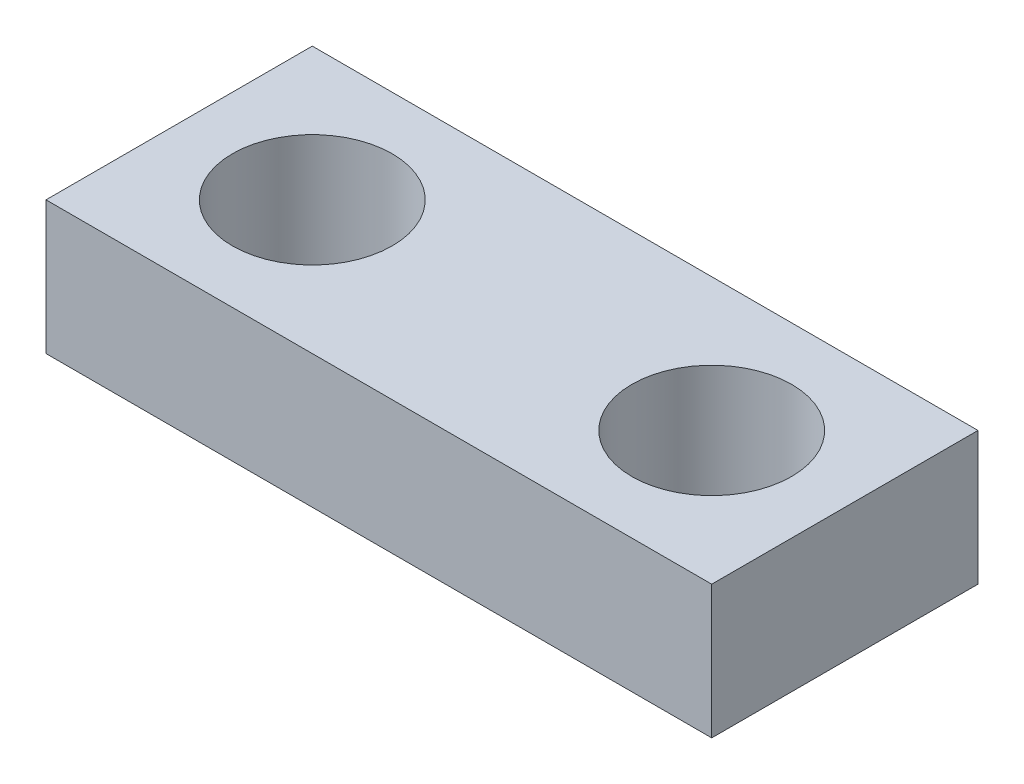
from build123d import *

# Parameters (mm, degrees)
SKETCH1_W           = 25
SKETCH1_H           = 10
SKETCH1_R           = 3
BOSS_EXTRUDE1_DEPTH = 2.5


with BuildPart() as part:
    # Sketch1 → Boss-Extrude1 (new, symmetric)
    with BuildSketch(Plane(origin=(0, 0, 0), x_dir=(1, 0, 0), z_dir=(0, 1, 0))):
        Rectangle(SKETCH1_W, SKETCH1_H)
        with Locations(Location((-7.5, 0, 0), (0, 0, 270))):
            Circle(SKETCH1_R, mode=Mode.SUBTRACT)
        with Locations(Location((7.5, 0, 0), (0, 0, 270))):
            Circle(SKETCH1_R, mode=Mode.SUBTRACT)
    extrude(amount=BOSS_EXTRUDE1_DEPTH, both=True)


solid = part.part
